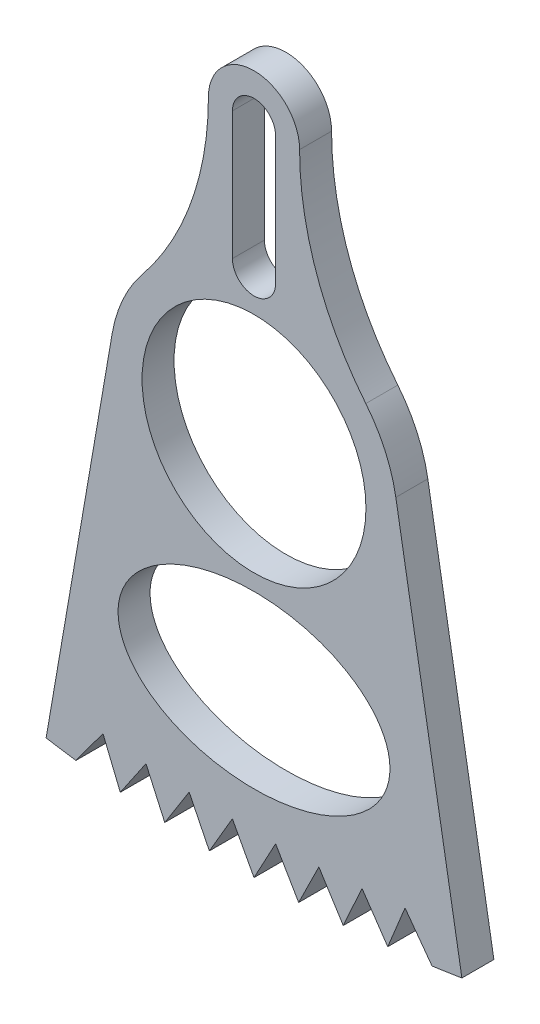
from build123d import *

# Parameters (mm, degrees)
SKETCH1_R           = 7
SKETCH1_RX          = 8.5
SKETCH1_RY          = 5.35
BOSS_EXTRUDE1_DEPTH = 1
CUT_EXTRUDE1_DEPTH  = 27.930466019


with BuildPart() as part:
    # Sketch1 → Boss-Extrude1 (new, symmetric)
    with BuildSketch(Plane.XY):
        with BuildLine():
            Line((-13, -22.436683487), (-8.869214361, 1.528736933))
            ThreePointArc((-8.869214361, 1.528736933), (-8.195662334, 3.719021229), (-6.990807006, 5.668211129))
            ThreePointArc((-6.990807006, 5.668211129), (-3.915823856, 11.153015373), (-2.85, 17.35))
            ThreePointArc((-2.85, 17.35), (0, 20.2), (2.85, 17.35))
            ThreePointArc((2.85, 17.35), (3.915823856, 11.153015373), (6.990807006, 5.668211129))
            ThreePointArc((6.990807006, 5.668211129), (8.195662334, 3.719021229), (8.869214361, 1.528736933))
            Line((8.869214361, 1.528736933), (13, -22.436683487))
            ThreePointArc((13, -22.436683487), (0, -23.5), (-13, -22.436683487))
        make_face()
        Circle(SKETCH1_R, mode=Mode.SUBTRACT)
        with Locations(Location((0, -13.35), (0, 0, 180))):
            Ellipse(SKETCH1_RX, SKETCH1_RY, mode=Mode.SUBTRACT)
        with BuildLine():
            Line((-1.35, 9.35), (-1.35, 17.35))
            ThreePointArc((-1.35, 17.35), (0, 18.7), (1.35, 17.35))
            Line((1.35, 17.35), (1.35, 9.35))
            ThreePointArc((1.35, 9.35), (0, 8), (-1.35, 9.35))
        make_face(mode=Mode.SUBTRACT)
    extrude(amount=BOSS_EXTRUDE1_DEPTH, both=True)

    # Sketch2 → Cut-Extrude1 (cut, through all)
    with BuildSketch(Plane.XY.offset(1)):
        with BuildLine():
            ThreePointArc((-11.133848077, -22.721445499), (-9.749547472, -22.903692131), (-8.362277061, -23.061751629))
            Line((-8.362277061, -23.061751629), (-9.444827704, -20.421948771))
            Line((-9.444827704, -20.421948771), (-11.133848077, -22.721445499))
        make_face()
        with BuildLine():
            ThreePointArc((-8.362277061, -23.061751629), (-6.97245942, -23.195575847), (-5.5805179, -23.305124021))
            Line((-5.5805179, -23.305124021), (-6.754536872, -20.704709731))
            Line((-6.754536872, -20.704709731), (-8.362277061, -23.061751629))
        make_face()
        with BuildLine():
            ThreePointArc((-5.5805179, -23.305124021), (-4.186876499, -23.39036278), (-2.791959736, -23.451266162))
            Line((-2.791959736, -23.451266162), (-4.056016678, -20.893408645))
            Line((-4.056016678, -20.893408645), (-5.5805179, -23.305124021))
        make_face()
        with BuildLine():
            Line((-1.352554853, -20.987815613), (-2.791959736, -23.451266162))
            ThreePointArc((-2.791959736, -23.451266162), (-1.396192515, -23.487815613), (0, -23.5))
            Line((0, -23.5), (-1.352554853, -20.987815613))
        make_face()
    cut_extrude1 = extrude(amount=-CUT_EXTRUDE1_DEPTH, mode=Mode.SUBTRACT)

    # Mirror1: Cut-Extrude1 across plane
    add(cut_extrude1.mirror(Plane(origin=(0, 0, 0), x_dir=(0, 0, 1), z_dir=(1, 0, 0))), mode=Mode.SUBTRACT)


solid = part.part
